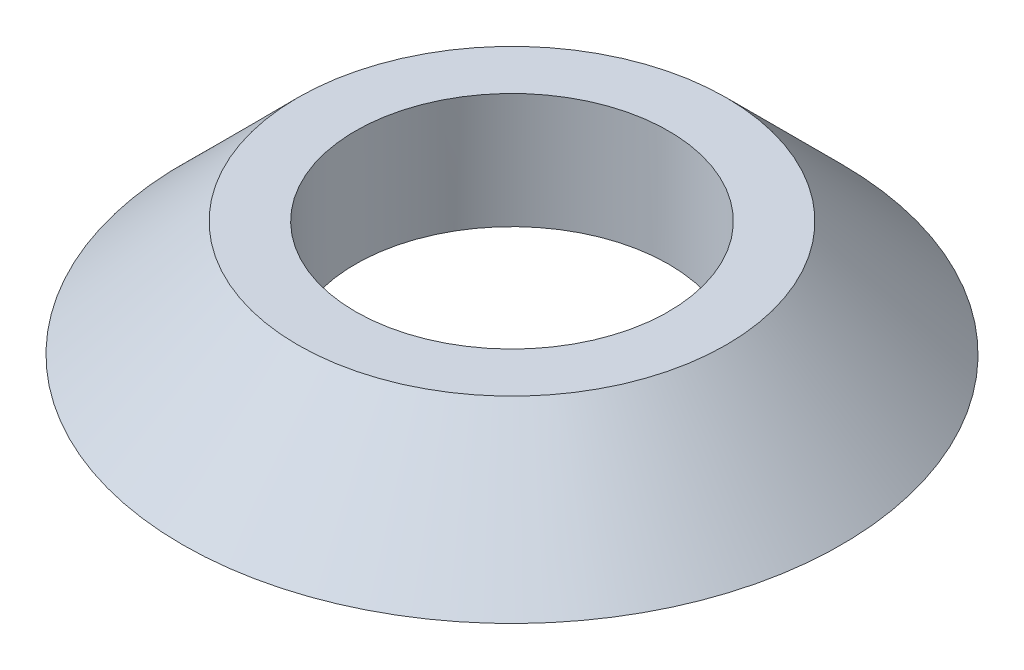
from build123d import *

# Parameters (mm, degrees)
SKETCH_2_R          = 9.5
CUT_EXTRUDE_1_DEPTH = 10


with BuildPart() as part:
    # 草图1 → 旋转1 (revolve)
    with BuildSketch(Plane.XY, mode=Mode.PRIVATE) as revolve_1_sk:
        Polygon((0, 0), (0, 7), (13, 7), (20, 0), align=None)
    revolve(revolve_1_sk.sketch.rotate(Axis((0, 0, 0), (0, 1, 0)), 90), axis=Axis((0, 0, 0), (0, 1, 0)))

    # 草图2 → 切除-拉伸1 (cut)
    with BuildSketch(Plane(origin=(0, 7, 0), x_dir=(1, 0, 0), z_dir=(0, 1, 0))):
        with Locations(Location((0, 0, 0), (0, 0, 270))):
            Circle(SKETCH_2_R)
    extrude(amount=-CUT_EXTRUDE_1_DEPTH, mode=Mode.SUBTRACT)


solid = part.part
